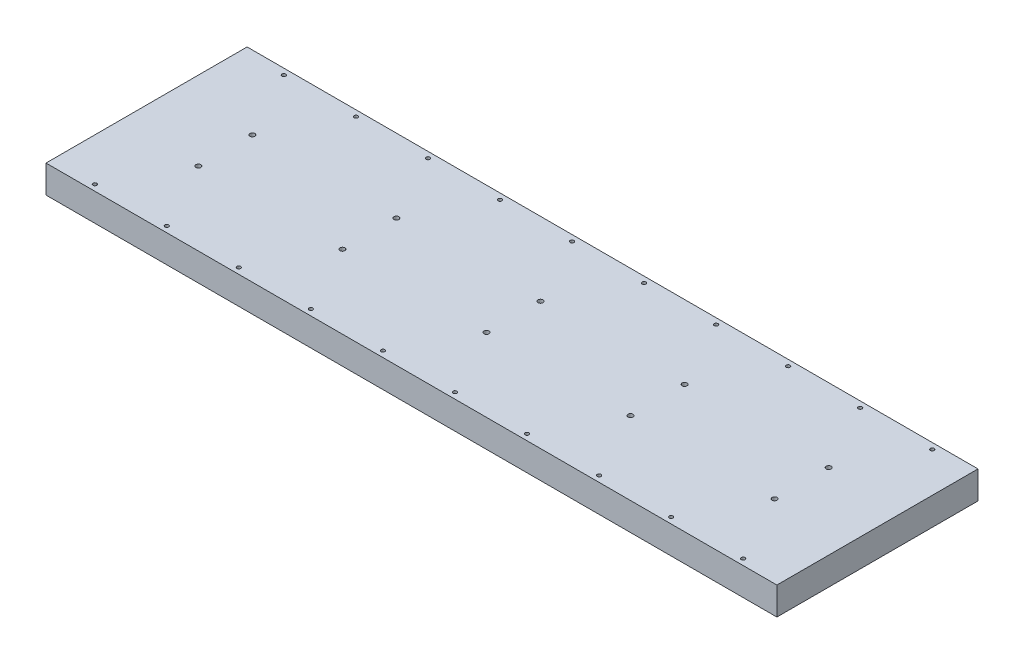
from build123d import *

# Parameters (mm, degrees)
SKETCH1_W                            = 487
SKETCH1_H                            = 134
BOSS_EXTRUDE1_DEPTH                  = 18.5
TAP_DRILL_FOR_M4X0_7_TAP1_AT_2_COUNT = 2
TAP_DRILL_FOR_M4X0_7_TAP1_AT_2_PITCH = 36
TAP_DRILL_FOR_M3X0_5_TAP1_AT_2_COUNT = 2
TAP_DRILL_FOR_M3X0_5_TAP1_AT_2_PITCH = 48
TAP_DRILL_FOR_M3X0_5_TAP1_AT_3_COUNT = 2
TAP_DRILL_FOR_M3X0_5_TAP1_AT_3_PITCH = 134.833230325
TAP_DRILL_FOR_M3X0_5_TAP1_AT_4_COUNT = 2
TAP_DRILL_FOR_M3X0_5_TAP1_AT_4_PITCH = 126
LPATTERN1_COUNT                      = 5
LPATTERN1_PITCH                      = 96


with BuildPart() as part:
    # Sketch1 → Boss-Extrude1 (new body)
    with BuildSketch(Plane(origin=(0, 0, 0), x_dir=(1, 0, 0), z_dir=(0, 1, 0))):
        Rectangle(SKETCH1_W, SKETCH1_H)
    extrude(amount=BOSS_EXTRUDE1_DEPTH)

    # Sketch3 → Tap Drill for M4x0.7 Tap1 (revolve, cut)
    with BuildSketch(Plane(origin=(-191, 18.5, -18), x_dir=(0, 0, 1), z_dir=(1, 0, 0))):
        Polygon((0, 0), (0, 18.371420021), (1.65, 17.38), (1.65, 0), align=None)
    tap_drill_for_m4x0_7_tap1 = revolve(axis=Axis((-191, 24.85, -18), (0, -1, 0)), mode=Mode.SUBTRACT)

    # Tap Drill for M4x0.7 Tap1 at 2: Tap Drill for M4x0.7 Tap1 ×2
    with Locations(*[(0, 0, i * TAP_DRILL_FOR_M4X0_7_TAP1_AT_2_PITCH) for i in range(1, TAP_DRILL_FOR_M4X0_7_TAP1_AT_2_COUNT)]):
        add(tap_drill_for_m4x0_7_tap1, mode=Mode.SUBTRACT)

    # Sketch5 → Tap Drill for M3x0.5 Tap1 (revolve, cut)
    with BuildSketch(Plane(origin=(-215, 18.5, -63), x_dir=(0, 0, 1), z_dir=(1, 0, 0))):
        Polygon((0, 0), (0, 18.131075774), (1.25, 17.38), (1.25, 0), align=None)
    tap_drill_for_m3x0_5_tap1 = revolve(axis=Axis((-215, 24.85, -63), (0, -1, 0)), mode=Mode.SUBTRACT)

    # Tap Drill for M3x0.5 Tap1 at 2: Tap Drill for M3x0.5 Tap1 ×2
    with Locations(*[(i * TAP_DRILL_FOR_M3X0_5_TAP1_AT_2_PITCH, 0, 0) for i in range(1, TAP_DRILL_FOR_M3X0_5_TAP1_AT_2_COUNT)]):
        add(tap_drill_for_m3x0_5_tap1, mode=Mode.SUBTRACT)

    # Tap Drill for M3x0.5 Tap1 at 3: Tap Drill for M3x0.5 Tap1 ×2
    with Locations(*[Vector(0.3559953275919878, 0, 0.9344877349289681) * (i * TAP_DRILL_FOR_M3X0_5_TAP1_AT_3_PITCH) for i in range(1, TAP_DRILL_FOR_M3X0_5_TAP1_AT_3_COUNT)]):
        add(tap_drill_for_m3x0_5_tap1, mode=Mode.SUBTRACT)

    # Tap Drill for M3x0.5 Tap1 at 4: Tap Drill for M3x0.5 Tap1 ×2
    with Locations(*[(0, 0, i * TAP_DRILL_FOR_M3X0_5_TAP1_AT_4_PITCH) for i in range(1, TAP_DRILL_FOR_M3X0_5_TAP1_AT_4_COUNT)]):
        add(tap_drill_for_m3x0_5_tap1, mode=Mode.SUBTRACT)

    # LPattern1: Tap Drill for M4x0.7 Tap1, Tap Drill for M3x0.5 Tap1 ×5
    with Locations(*[(i * LPATTERN1_PITCH, 0, 0) for i in range(1, LPATTERN1_COUNT)]):
        add(tap_drill_for_m4x0_7_tap1, mode=Mode.SUBTRACT)
        add(tap_drill_for_m3x0_5_tap1, mode=Mode.SUBTRACT)

    # LPattern1 copy 1 sketch → LPattern1 copy 1 (revolve, cut)
    with BuildSketch(Plane(origin=(-95, 18.5, 18), x_dir=(0, 0, 1), z_dir=(1, 0, 0))):
        Polygon((0, 0), (0, 18.371420021), (1.65, 17.38), (1.65, 0), align=None)
    revolve(axis=Axis((-95, 24.85, 18), (0, -1, 0)), mode=Mode.SUBTRACT)

    # LPattern1 copy 2 sketch → LPattern1 copy 2 (revolve, cut)
    with BuildSketch(Plane(origin=(1, 18.5, 18), x_dir=(0, 0, 1), z_dir=(1, 0, 0))):
        Polygon((0, 0), (0, 18.371420021), (1.65, 17.38), (1.65, 0), align=None)
    revolve(axis=Axis((1, 24.85, 18), (0, -1, 0)), mode=Mode.SUBTRACT)

    # LPattern1 copy 3 sketch → LPattern1 copy 3 (revolve, cut)
    with BuildSketch(Plane(origin=(97, 18.5, 18), x_dir=(0, 0, 1), z_dir=(1, 0, 0))):
        Polygon((0, 0), (0, 18.371420021), (1.65, 17.38), (1.65, 0), align=None)
    revolve(axis=Axis((97, 24.85, 18), (0, -1, 0)), mode=Mode.SUBTRACT)

    # LPattern1 copy 4 sketch → LPattern1 copy 4 (revolve, cut)
    with BuildSketch(Plane(origin=(193, 18.5, 18), x_dir=(0, 0, 1), z_dir=(1, 0, 0))):
        Polygon((0, 0), (0, 18.371420021), (1.65, 17.38), (1.65, 0), align=None)
    revolve(axis=Axis((193, 24.85, 18), (0, -1, 0)), mode=Mode.SUBTRACT)

    # LPattern1 copy 5 sketch → LPattern1 copy 5 (revolve, cut)
    with BuildSketch(Plane(origin=(-71, 18.5, -63), x_dir=(0, 0, 1), z_dir=(1, 0, 0))):
        Polygon((0, 0), (0, 18.131075774), (1.25, 17.38), (1.25, 0), align=None)
    revolve(axis=Axis((-71, 24.85, -63), (0, -1, 0)), mode=Mode.SUBTRACT)

    # LPattern1 copy 6 sketch → LPattern1 copy 6 (revolve, cut)
    with BuildSketch(Plane(origin=(25, 18.5, -63), x_dir=(0, 0, 1), z_dir=(1, 0, 0))):
        Polygon((0, 0), (0, 18.131075774), (1.25, 17.38), (1.25, 0), align=None)
    revolve(axis=Axis((25, 24.85, -63), (0, -1, 0)), mode=Mode.SUBTRACT)

    # LPattern1 copy 7 sketch → LPattern1 copy 7 (revolve, cut)
    with BuildSketch(Plane(origin=(121, 18.5, -63), x_dir=(0, 0, 1), z_dir=(1, 0, 0))):
        Polygon((0, 0), (0, 18.131075774), (1.25, 17.38), (1.25, 0), align=None)
    revolve(axis=Axis((121, 24.85, -63), (0, -1, 0)), mode=Mode.SUBTRACT)

    # LPattern1 copy 8 sketch → LPattern1 copy 8 (revolve, cut)
    with BuildSketch(Plane(origin=(217, 18.5, -63), x_dir=(0, 0, 1), z_dir=(1, 0, 0))):
        Polygon((0, 0), (0, 18.131075774), (1.25, 17.38), (1.25, 0), align=None)
    revolve(axis=Axis((217, 24.85, -63), (0, -1, 0)), mode=Mode.SUBTRACT)

    # LPattern1 copy 9 sketch → LPattern1 copy 9 (revolve, cut)
    with BuildSketch(Plane(origin=(-71, 18.5, 63), x_dir=(0, 0, 1), z_dir=(1, 0, 0))):
        Polygon((0, 0), (0, 18.131075774), (1.25, 17.38), (1.25, 0), align=None)
    revolve(axis=Axis((-71, 24.85, 63), (0, -1, 0)), mode=Mode.SUBTRACT)

    # LPattern1 copy 10 sketch → LPattern1 copy 10 (revolve, cut)
    with BuildSketch(Plane(origin=(25, 18.5, 63), x_dir=(0, 0, 1), z_dir=(1, 0, 0))):
        Polygon((0, 0), (0, 18.131075774), (1.25, 17.38), (1.25, 0), align=None)
    revolve(axis=Axis((25, 24.85, 63), (0, -1, 0)), mode=Mode.SUBTRACT)

    # LPattern1 copy 11 sketch → LPattern1 copy 11 (revolve, cut)
    with BuildSketch(Plane(origin=(121, 18.5, 63), x_dir=(0, 0, 1), z_dir=(1, 0, 0))):
        Polygon((0, 0), (0, 18.131075774), (1.25, 17.38), (1.25, 0), align=None)
    revolve(axis=Axis((121, 24.85, 63), (0, -1, 0)), mode=Mode.SUBTRACT)

    # LPattern1 copy 12 sketch → LPattern1 copy 12 (revolve, cut)
    with BuildSketch(Plane(origin=(217, 18.5, 63), x_dir=(0, 0, 1), z_dir=(1, 0, 0))):
        Polygon((0, 0), (0, 18.131075774), (1.25, 17.38), (1.25, 0), align=None)
    revolve(axis=Axis((217, 24.85, 63), (0, -1, 0)), mode=Mode.SUBTRACT)

    # LPattern1 copy 13 sketch → LPattern1 copy 13 (revolve, cut)
    with BuildSketch(Plane(origin=(-119, 18.5, 63), x_dir=(0, 0, 1), z_dir=(1, 0, 0))):
        Polygon((0, 0), (0, 18.131075774), (1.25, 17.38), (1.25, 0), align=None)
    revolve(axis=Axis((-119, 24.85, 63), (0, -1, 0)), mode=Mode.SUBTRACT)

    # LPattern1 copy 14 sketch → LPattern1 copy 14 (revolve, cut)
    with BuildSketch(Plane(origin=(-23, 18.5, 63), x_dir=(0, 0, 1), z_dir=(1, 0, 0))):
        Polygon((0, 0), (0, 18.131075774), (1.25, 17.38), (1.25, 0), align=None)
    revolve(axis=Axis((-23, 24.85, 63), (0, -1, 0)), mode=Mode.SUBTRACT)

    # LPattern1 copy 15 sketch → LPattern1 copy 15 (revolve, cut)
    with BuildSketch(Plane(origin=(73, 18.5, 63), x_dir=(0, 0, 1), z_dir=(1, 0, 0))):
        Polygon((0, 0), (0, 18.131075774), (1.25, 17.38), (1.25, 0), align=None)
    revolve(axis=Axis((73, 24.85, 63), (0, -1, 0)), mode=Mode.SUBTRACT)

    # LPattern1 copy 16 sketch → LPattern1 copy 16 (revolve, cut)
    with BuildSketch(Plane(origin=(169, 18.5, 63), x_dir=(0, 0, 1), z_dir=(1, 0, 0))):
        Polygon((0, 0), (0, 18.131075774), (1.25, 17.38), (1.25, 0), align=None)
    revolve(axis=Axis((169, 24.85, 63), (0, -1, 0)), mode=Mode.SUBTRACT)


solid = part.part
